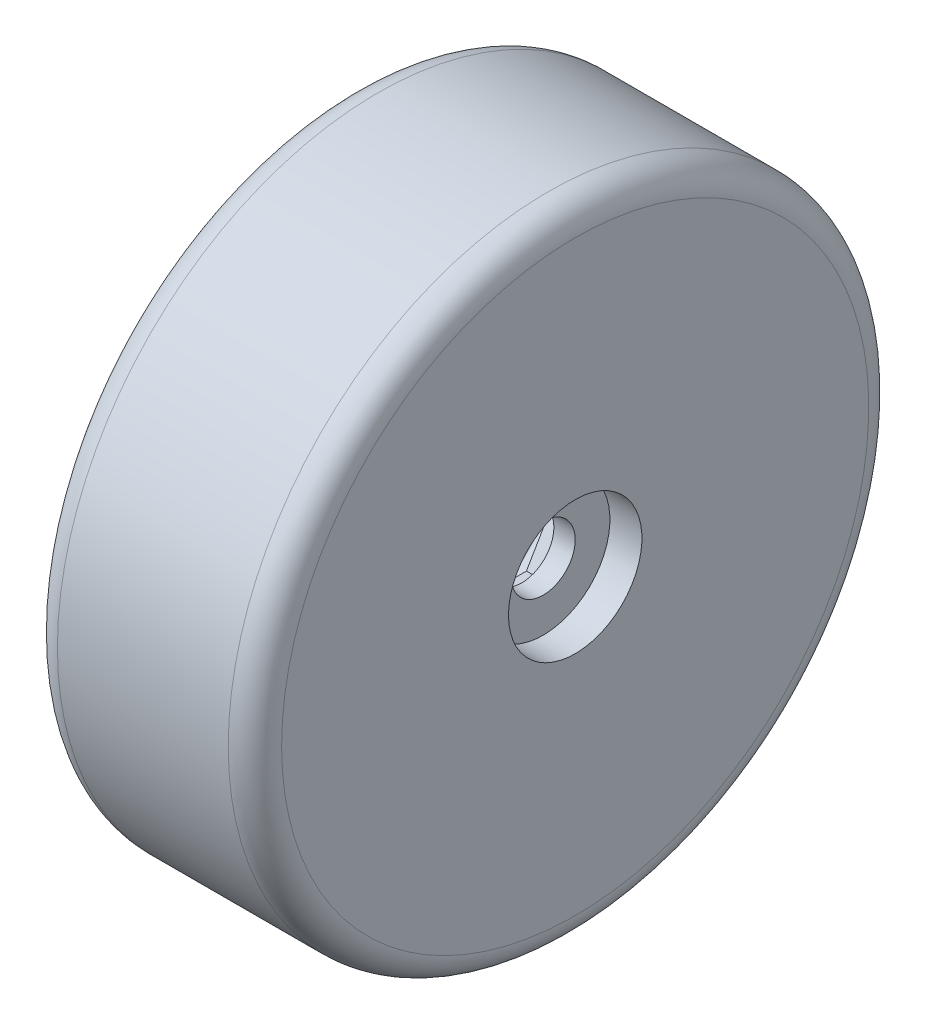
from build123d import *

# Parameters (mm, degrees)
CUT_EXTRUDE1_DEPTH = 4
SKETCH3_W          = 6
SKETCH3_H          = 12.5


with BuildPart() as part:
    # Sketch1 → Revolve1 (revolve)
    with BuildSketch(Plane.XY, mode=Mode.PRIVATE) as revolve1_sk:
        with BuildLine():
            Line((0, -6), (0, -55))
            ThreePointArc((0, -55), (-1.464466094, -58.535533906), (-5, -60))
            Line((-5, -60), (-37, -60))
            ThreePointArc((-37, -60), (-40.535533906, -58.535533906), (-42, -55))
            Line((-42, -55), (-42, -45))
            ThreePointArc((-42, -45), (-40.535533906, -41.464466094), (-37, -40))
            Line((-37, -40), (-19, -40))
            ThreePointArc((-19, -40), (-15.464466094, -38.535533906), (-14, -35))
            Line((-14, -35), (-14, -6))
            Line((-14, -6), (0, -6))
        make_face()
    revolve(revolve1_sk.sketch.rotate(Axis((-33.627906977, 0, 0), (1, 0, 0)), 270), axis=Axis((-33.627906977, 0, 0), (1, 0, 0)))

    # Sketch2 → Cut-Extrude1 (cut)
    with BuildSketch(Plane.ZY.offset(14)):
        Polygon((4.948031545, -8.47645664), (9.814842556, 0.046892697), (4.866811012, 8.523349336), (-4.948031545, 8.47645664), (-9.814842556, -0.046892697), (-4.866811012, -8.523349336), align=None)
    extrude(amount=-CUT_EXTRUDE1_DEPTH, mode=Mode.SUBTRACT)

    # Sketch3 → Cut-Revolve1 (revolve, cut)
    with BuildSketch(Plane.XY, mode=Mode.PRIVATE) as cut_revolve1_sk:
        with Locations((-3, -6.25)):
            Rectangle(SKETCH3_W, SKETCH3_H)
    revolve(cut_revolve1_sk.sketch.rotate(Axis((-6, 0, 0), (1, 0, 0)), 270), axis=Axis((-6, 0, 0), (1, 0, 0)), mode=Mode.SUBTRACT)


solid = part.part
